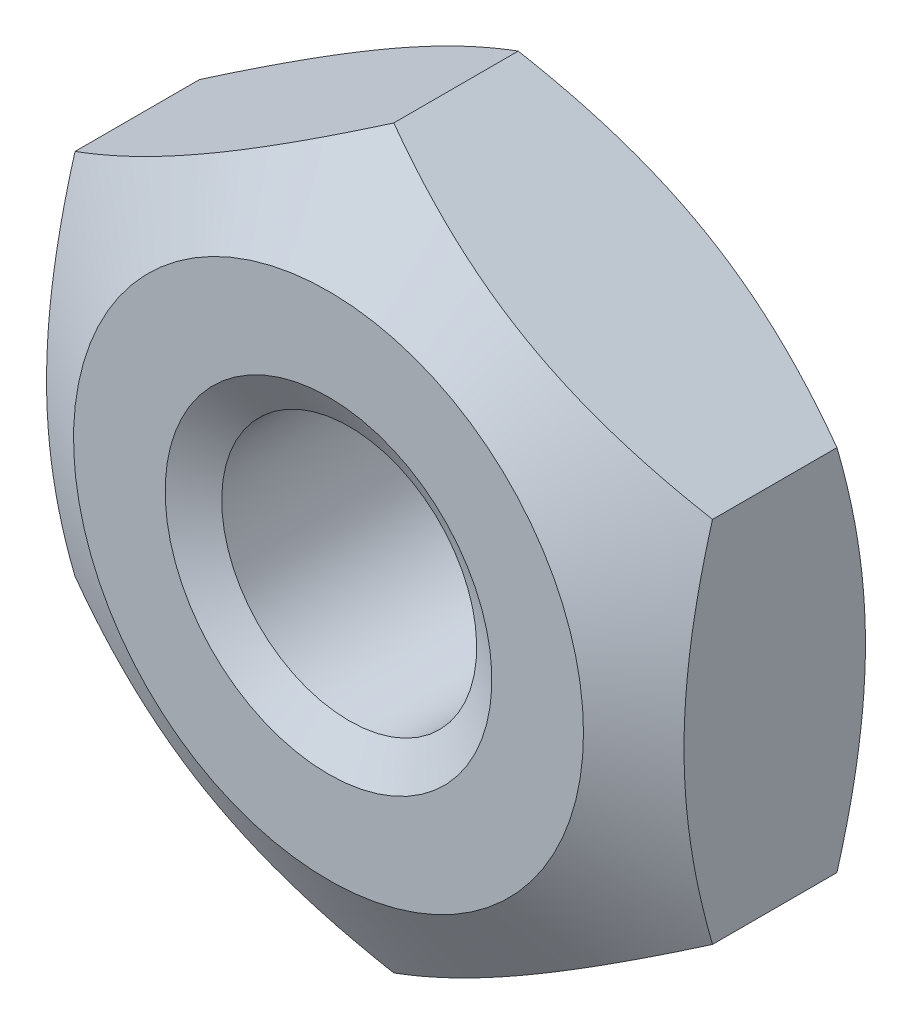
from build123d import *

# Parameters (mm, degrees)
BOSS_EXTRUDE1_DEPTH = 1.6


with BuildPart() as part:
    # Sketch1 → Boss-Extrude1 (new body)
    with BuildSketch(Plane.XY):
        Polygon((0, 2.309401077), (-2, 1.154700538), (-2, -1.154700538), (0, -2.309401077), (2, -1.154700538), (2, 1.154700538), align=None)
    extrude(amount=-BOSS_EXTRUDE1_DEPTH)

    # Sketch4 → Cut-Revolve1 (revolve, cut)
    with BuildSketch(Plane(origin=(0, 0, 0), x_dir=(0, 0, -1), z_dir=(1, 0, 0)), mode=Mode.PRIVATE) as cut_revolve1_sk:
        Polygon((1.6, 2.309401077), (1.190427097, 2.309401077), (1.6, 1.6), align=None)
        Polygon((0, 2.309401077), (0.409572903, 2.309401077), (0, 1.6), align=None)
    revolve(cut_revolve1_sk.sketch.rotate(Axis((0, 0, 0), (0, 0, -1)), 299.99999989), axis=Axis((0, 0, 0), (0, 0, -1)), mode=Mode.SUBTRACT)

    # Sketch5 → Cut-Revolve2 (revolve, cut)
    with BuildSketch(Plane(origin=(0, 0, 0), x_dir=(0, 0, -1), z_dir=(1, 0, 0)), mode=Mode.PRIVATE) as cut_revolve2_sk:
        Polygon((0, 0), (0, 1.025), (0.129903811, 0.8), (1.470096189, 0.8), (1.6, 1.025), (1.6, 0), align=None)
    revolve(cut_revolve2_sk.sketch.rotate(Axis((0, 0, 0), (0, 0, -1)), 180), axis=Axis((0, 0, 0), (0, 0, -1)), mode=Mode.SUBTRACT)


solid = part.part
